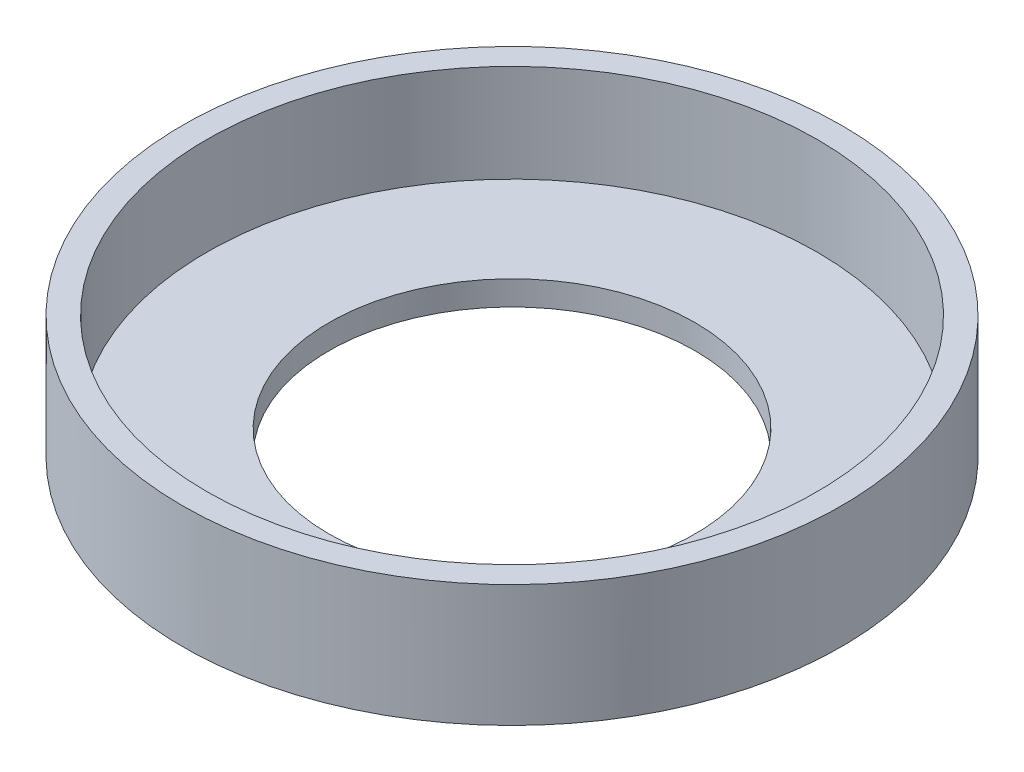
from build123d import *

# Parameters (mm, degrees)
SKETCH1_R           = 13.5
SKETCH1_R_2         = 12.5
BOSS_EXTRUDE1_DEPTH = 4
BOSS_EXTRUDE2_START = 1
SKETCH2_R           = 13.5
SKETCH2_R_2         = 7.5
BOSS_EXTRUDE2_DEPTH = 1


with BuildPart() as part:
    # Sketch1 → Boss-Extrude1 (new body)
    with BuildSketch(Plane(origin=(0, 0, 0), x_dir=(1, 0, 0), z_dir=(0, 1, 0))):
        with Locations(Location((0, 0, 0), (0, 0, 270))):
            Circle(SKETCH1_R)
        with Locations(Location((0, 0, 0), (0, 0, 270))):
            Circle(SKETCH1_R_2, mode=Mode.SUBTRACT)
    extrude(amount=BOSS_EXTRUDE1_DEPTH)

    # Sketch2 → Boss-Extrude2 (add)
    with BuildSketch(Plane.XZ.offset(BOSS_EXTRUDE2_START)):
        with Locations(Location((0, 0, 0), (0, 0, 270))):
            Circle(SKETCH2_R)
        with Locations(Location((0, 0, 0), (0, 0, 270))):
            Circle(SKETCH2_R_2, mode=Mode.SUBTRACT)
    extrude(amount=-BOSS_EXTRUDE2_DEPTH)


solid = part.part
